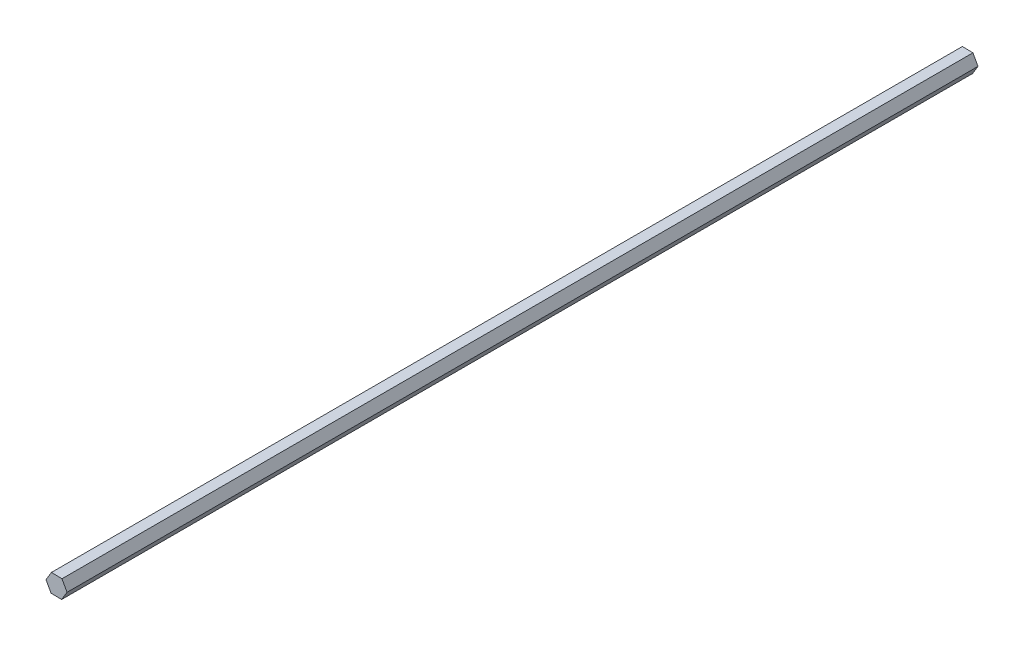
from build123d import *

# Parameters (mm, degrees)
BOSS_EXTRUDE1_DEPTH = 635


with BuildPart() as part:
    # Sketch1 → Boss-Extrude1 (new body)
    with BuildSketch(Plane.XY):
        Polygon((3.522574221, -6.430770108), (7.330497391, -0.164746292), (3.807923169, 6.266023817), (-3.522574221, 6.430770108), (-7.330497391, 0.164746292), (-3.807923169, -6.266023817), align=None)
    extrude(amount=BOSS_EXTRUDE1_DEPTH)


solid = part.part
